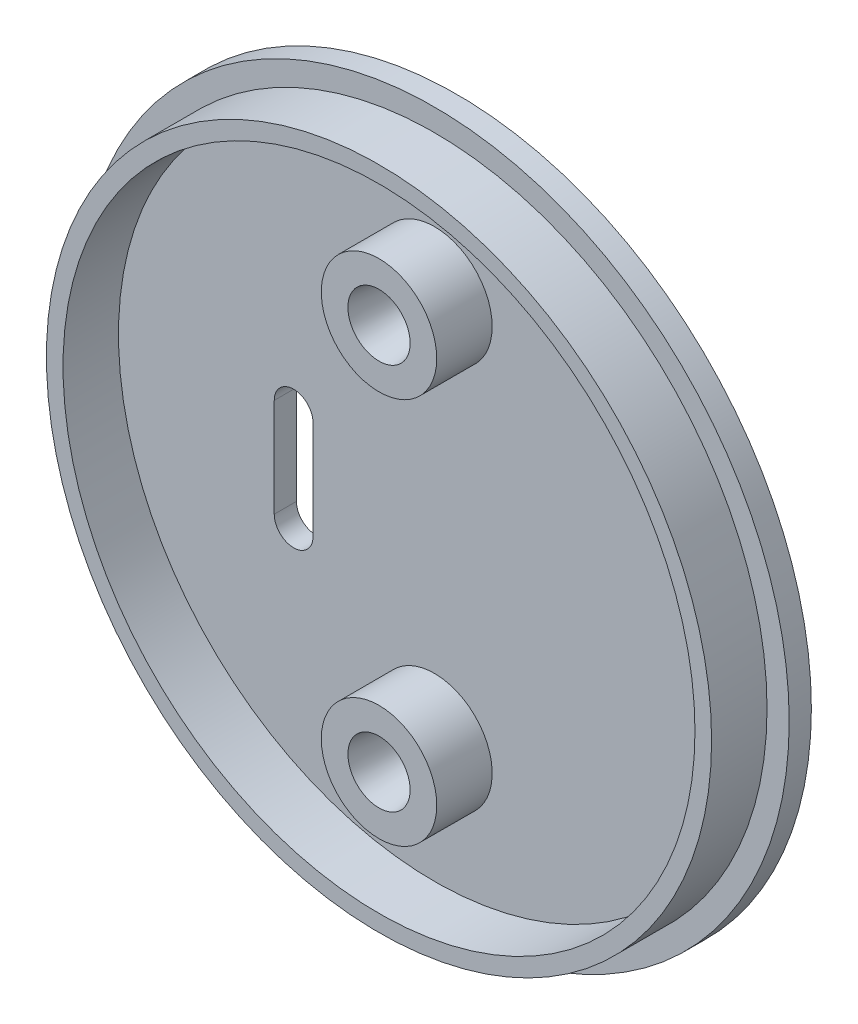
from build123d import *

# Parameters (mm, degrees)
SKETCH1_R                    = 32
BOSS_EXTRUDE1_DEPTH          = 0.999998
SKETCH8_R                    = 30
SKETCH8_R_2                  = 28.5
BOSS_EXTRUDE4_DEPTH          = 5
SKETCH9_R                    = 5.207
BOSS_EXTRUDE5_DEPTH          = 5
CUT_EXTRUDE1_DEPTH           = 46.793011956
CUT_EXTRUDE1_DEPTH_BACK      = 46.793011956
SKETCH10_R                   = 2.8067
CUT_EXTRUDE2_DEPTH           = 4.7
CUT_EXTRUDE2_DRAFT           = -8
CUT_EXTRUDE2_PROFILE_2_DEPTH = 4.7
CUT_EXTRUDE2_PROFILE_2_DRAFT = -8


with BuildPart() as part:
    # Sketch1 → Boss-Extrude1 (new, symmetric)
    with BuildSketch(Plane.XY):
        Circle(SKETCH1_R)
    extrude(amount=BOSS_EXTRUDE1_DEPTH, both=True)

    # Sketch8 → Boss-Extrude4 (add)
    with BuildSketch(Plane.XY.offset(0.999998)):
        Circle(SKETCH8_R)
        Circle(SKETCH8_R_2, mode=Mode.SUBTRACT)
    extrude(amount=BOSS_EXTRUDE4_DEPTH)

    # Sketch9 → Boss-Extrude5 (add)
    with BuildSketch(Plane.XY.offset(0.999998)):
        with Locations((0, 17.4498)):
            Circle(SKETCH9_R)
        with Locations(Location((0, -17.4498, 0), (0, 0, 180))):
            Circle(SKETCH9_R)
    extrude(amount=BOSS_EXTRUDE5_DEPTH)

    # Sketch7 → Cut-Extrude1 (cut, two sides: drawn at the far end of the back side and taken through both)
    with BuildSketch(Plane(origin=(0, 0, -0.999998), x_dir=(-1, 0, 0), z_dir=(0, 0, -1)).offset(-CUT_EXTRUDE1_DEPTH_BACK)):
        with BuildLine():
            Line((14.45, 1.8542), (14.45, -7.0358))
            ThreePointArc((14.45, -7.0358), (12.7, -8.7858), (10.95, -7.0358))
            Line((10.95, -7.0358), (10.95, 1.8542))
            ThreePointArc((10.95, 1.8542), (12.7, 3.6042), (14.45, 1.8542))
        make_face()
    extrude(amount=CUT_EXTRUDE1_DEPTH + CUT_EXTRUDE1_DEPTH_BACK, mode=Mode.SUBTRACT)


with BuildPart() as cut_extrude2_tool:
    # Sketch10 → Cut-Extrude2 (with draft: the straight prism first)
    with BuildSketch(Plane.XY.offset(5.999998)):
        with Locations((0, 17.4498)):
            Circle(SKETCH10_R)
    extrude(amount=-CUT_EXTRUDE2_DEPTH)
    # Cut-Extrude2: the draft: its side faces are tilted about the plane it starts from
    cut_extrude2_sides = [cut_extrude2_tool.faces().sort_by_distance(p)[0] for p in [
        (-2.8067, 17.4498, 3.649998),
    ]]
    draft(cut_extrude2_sides, Plane.XY.offset(5.999998), CUT_EXTRUDE2_DRAFT)


with BuildPart() as part_1:
    add(part.part)

    # Cut-Extrude2: cut by cut_extrude2_tool
    add(cut_extrude2_tool.part, mode=Mode.SUBTRACT)


with BuildPart() as cut_extrude2_profile_2_tool:
    # Sketch10 → Cut-Extrude2 profile 2 (with draft: the straight prism first)
    with BuildSketch(Plane.XY.offset(5.999998)):
        with Locations((0, -17.4498)):
            Circle(SKETCH10_R)
    extrude(amount=-CUT_EXTRUDE2_PROFILE_2_DEPTH)
    # Cut-Extrude2 profile 2: the draft: its side faces are tilted about the plane it starts from
    cut_extrude2_profile_2_sides = [cut_extrude2_profile_2_tool.faces().sort_by_distance(p)[0] for p in [
        (-2.8067, -17.4498, 3.649998),
    ]]
    draft(cut_extrude2_profile_2_sides, Plane.XY.offset(5.999998), CUT_EXTRUDE2_PROFILE_2_DRAFT)


with BuildPart() as part_2:
    add(part_1.part)

    # Cut-Extrude2 profile 2: cut by cut_extrude2_profile_2_tool
    add(cut_extrude2_profile_2_tool.part, mode=Mode.SUBTRACT)


solid = part_2.part
